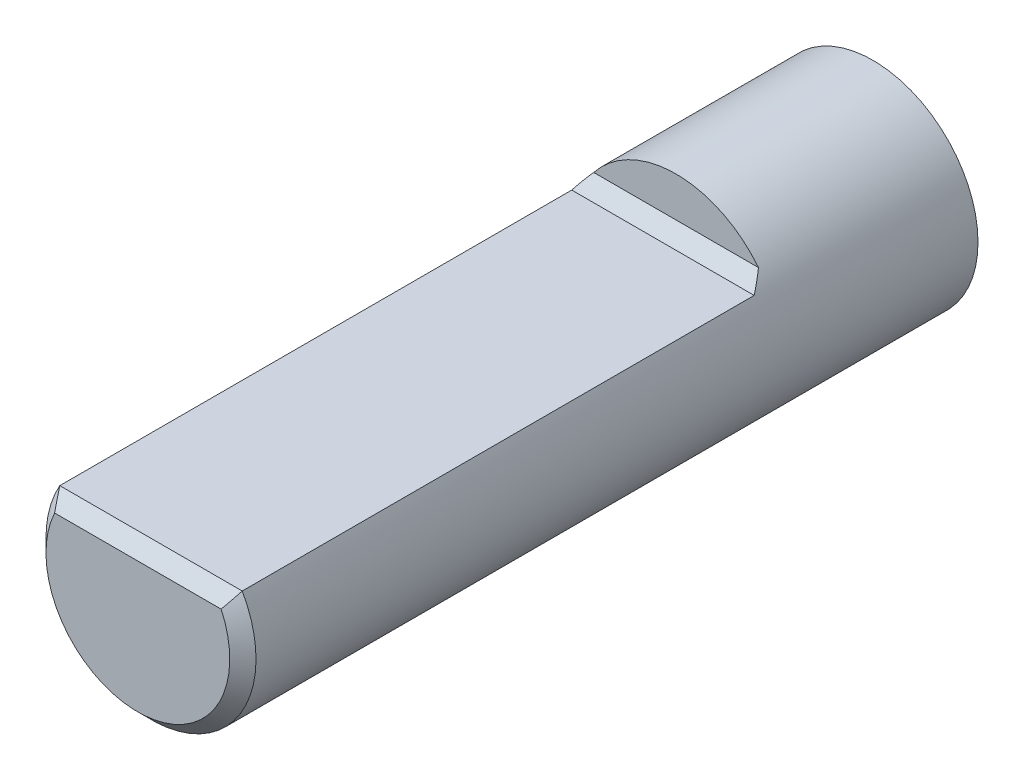
from build123d import *

# Parameters (mm, degrees)
SKETCH2_R           = 4
BOSS_EXTRUDE1_DEPTH = 28
CUT_EXTRUDE1_DEPTH  = 20.5
CHAMFER2_SIZE       = 0.5


with BuildPart() as part:
    # Sketch2 → Boss-Extrude1 (new body)
    with BuildSketch(Plane.XY):
        Circle(SKETCH2_R)
    extrude(amount=BOSS_EXTRUDE1_DEPTH)

    # Sketch4 → Cut-Extrude1 (cut)
    with BuildSketch(Plane.XY.offset(28)):
        Polygon((-3.475, 1.981003534), (3.475, 1.981003534), (3.475, 4), (0, 4), (-3.475, 4), align=None)
    extrude(amount=-CUT_EXTRUDE1_DEPTH, mode=Mode.SUBTRACT)

    # Chamfer2
    chamfer2_edges = [part.edges().sort_by_distance(p)[0] for p in [
        (0, 1.981003534, 7.5),
        (-1.024695077, -3.866522986, 28),
        (0, 1.981003534, 28),
    ]]
    chamfer(chamfer2_edges, length=CHAMFER2_SIZE)


solid = part.part
